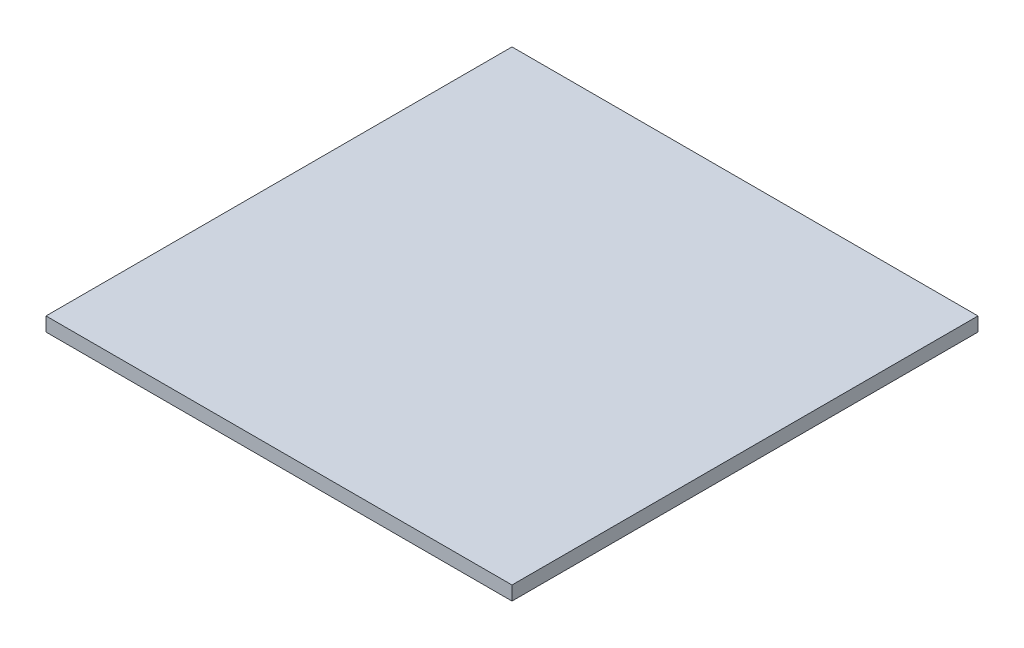
from build123d import *

# Parameters (mm, degrees)
SKETCH1_W           = 10
SKETCH1_H           = 10
BOSS_EXTRUDE1_DEPTH = 0.3


with BuildPart() as part:
    # Sketch1 → Boss-Extrude1 (new body)
    with BuildSketch(Plane(origin=(0, 0, 0), x_dir=(1, 0, 0), z_dir=(0, 1, 0))):
        with Locations((5, 5)):
            Rectangle(SKETCH1_W, SKETCH1_H)
    extrude(amount=BOSS_EXTRUDE1_DEPTH)


solid = part.part
